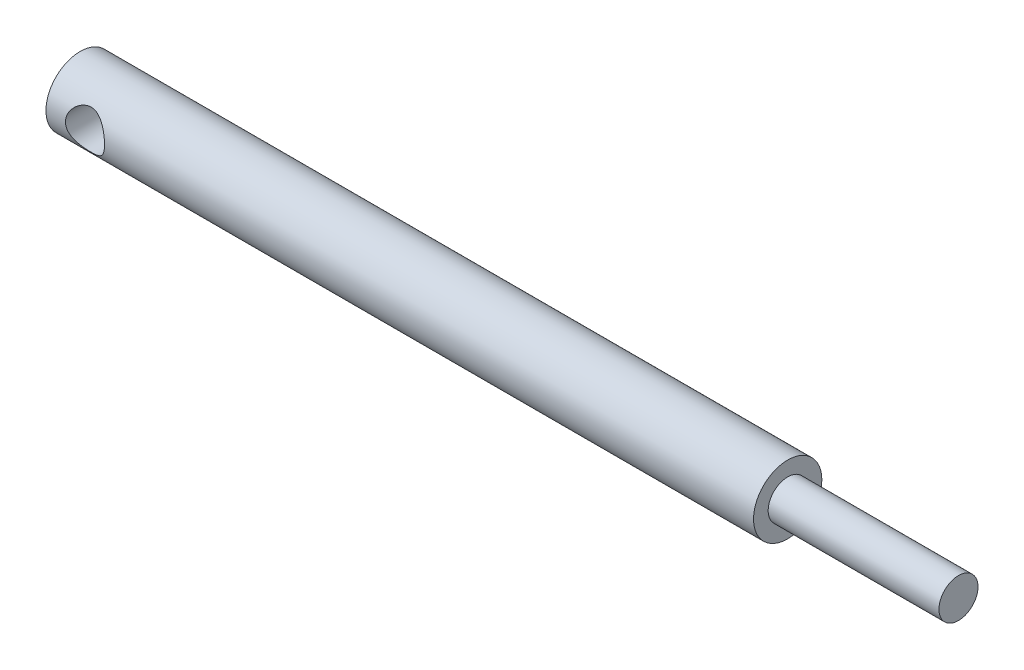
from build123d import *

# Parameters (mm, degrees)
CUT_EXTRUDE_1_DEPTH      = 181.272016686
CUT_EXTRUDE_1_DEPTH_BACK = 181.272016686
SKETCH_3_R               = 4


with BuildPart() as part:
    # 草图1 → 旋转1 (revolve)
    with BuildSketch(Plane.XY, mode=Mode.PRIVATE) as revolve_1_sk:
        Polygon((0, 7), (0, 0), (180, 0), (180, 4), (145, 4), (145, 7), align=None)
    revolve(revolve_1_sk.sketch.rotate(Axis((0, 0, 0), (1, 0, 0)), 270), axis=Axis((0, 0, 0), (1, 0, 0)))

    # 草图3 → 切除-拉伸1 (cut, two sides: drawn at the far end of the back side and taken through both)
    with BuildSketch(Plane.XY.offset(-CUT_EXTRUDE_1_DEPTH_BACK)):
        with Locations((8, 0)):
            Circle(SKETCH_3_R)
    extrude(amount=CUT_EXTRUDE_1_DEPTH + CUT_EXTRUDE_1_DEPTH_BACK, mode=Mode.SUBTRACT)


solid = part.part
